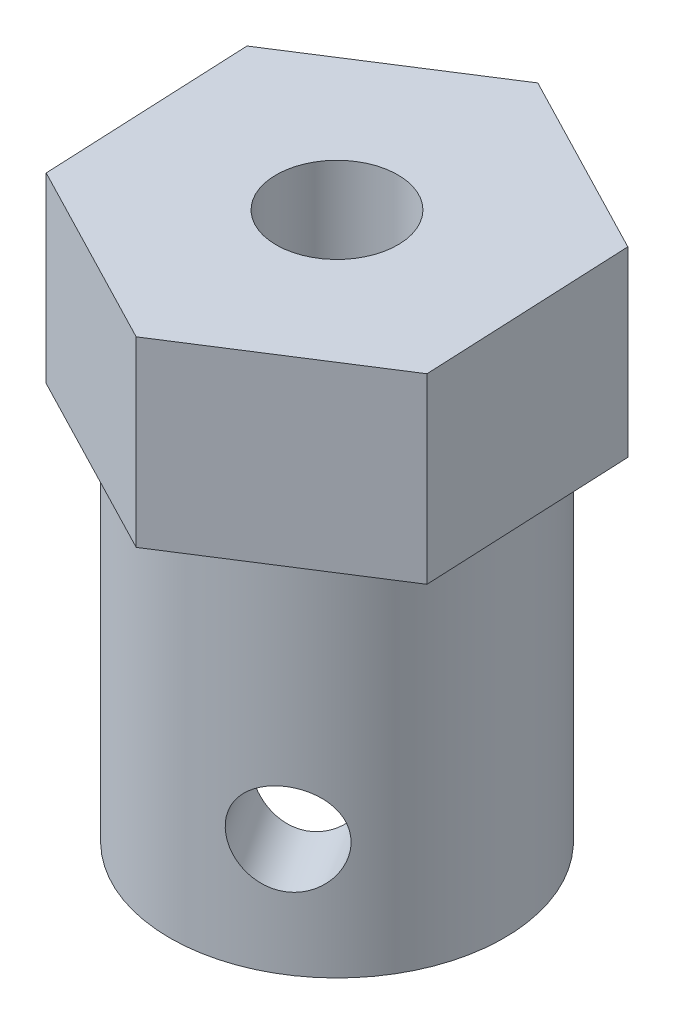
from build123d import *

# Parameters (mm, degrees)
SKETCH_1_R          = 2
EXTRUDE_1_DEPTH     = 6
SKETCH_1_3_R        = 5.5
SKETCH_1_3_R_2      = 3
EXTRUDE_2_DEPTH     = 12
SKETCH_2_R          = 1.5
CUT_EXTRUDE_1_DEPTH = 30


with BuildPart() as part:
    # 草图1 → 凸台-拉伸1 (new body)
    with BuildSketch(Plane(origin=(0, 0, 0), x_dir=(1, 0, 0), z_dir=(0, 1, 0))):
        Polygon((5.837094583, 3.732067367), (-0.313517857, 6.921105876), (-6.15061244, 3.18903851), (-5.837094583, -3.732067367), (0.313517857, -6.921105876), (6.15061244, -3.18903851), align=None)
        Circle(SKETCH_1_R, mode=Mode.SUBTRACT)
    extrude(amount=EXTRUDE_1_DEPTH)

    # 草图1<3> → 凸台-拉伸2 (add)
    with BuildSketch(Plane(origin=(0, 0, 0), x_dir=(1, 0, 0), z_dir=(0, 1, 0))):
        Circle(SKETCH_1_3_R)
        Circle(SKETCH_1_3_R_2, mode=Mode.SUBTRACT)
    extrude(amount=-EXTRUDE_2_DEPTH)

    # 草图2 → 切除-拉伸1 (cut)
    with BuildSketch(Plane(origin=(3.232065148, 0, 5.055072193), x_dir=(0.8425120321737304, 0, -0.5386775247237361), z_dir=(0.538677524723736, 0, 0.8425120321737303))):
        with Locations((0, -8.135313369)):
            Circle(SKETCH_2_R)
    extrude(amount=-CUT_EXTRUDE_1_DEPTH, mode=Mode.SUBTRACT)


solid = part.part
